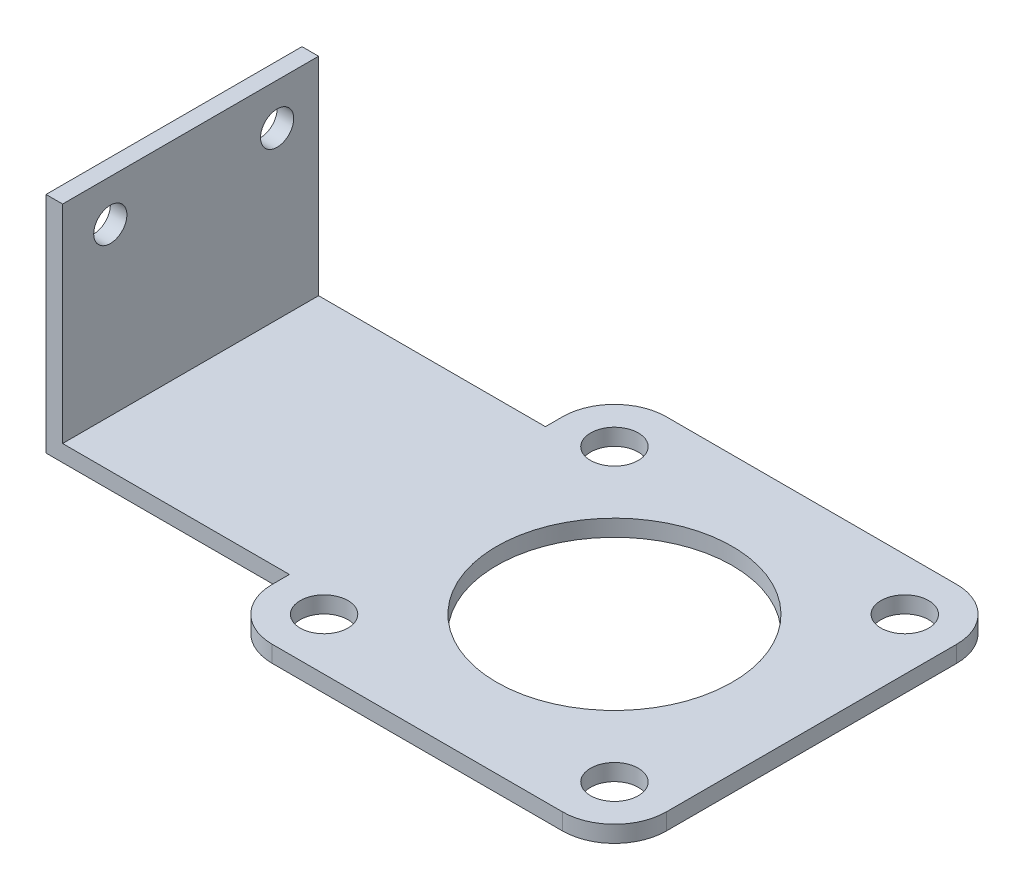
from build123d import *

# Parameters (mm, degrees)
BOSS_EXTRUDE1_DEPTH     = 4
CUT_EXTRUDE1_DEPTH      = 10
CUT_EXTRUDE1_DEPTH_BACK = 10
SKETCH2_R               = 5.75
BOSS_EXTRUDE5_DEPTH     = 58.68
SKETCH12_W              = 4
SKETCH12_H              = 61.717483032
BOSS_EXTRUDE8_DEPTH     = 50
SKETCH13_R              = 4
CUT_EXTRUDE5_DEPTH      = 20
SKETCH14_R              = 28.395
CUT_EXTRUDE6_DEPTH      = 10


with BuildPart() as part:
    # Sketch1 → Boss-Extrude1 (new body)
    with BuildSketch(Plane(origin=(0, 0, 0), x_dir=(1, 0, 0), z_dir=(0, 1, 0))):
        with BuildLine():
            Line((12.5, 0), (82.5, 0))
            ThreePointArc((82.5, 0), (91.338834765, 3.661165235), (95, 12.5))
            Line((95, 12.5), (95, 82.5))
            ThreePointArc((95, 82.5), (91.338834765, 91.338834765), (82.5, 95))
            Line((82.5, 95), (12.5, 95))
            ThreePointArc((12.5, 95), (3.661165235, 91.338834765), (0, 82.5))
            Line((0, 82.5), (0, 12.5))
            ThreePointArc((0, 12.5), (3.661165235, 3.661165235), (12.5, 0))
        make_face()
    extrude(amount=BOSS_EXTRUDE1_DEPTH)

    # Sketch2 → Cut-Extrude1 (cut, two sides: drawn at the far end of the back side and taken through both)
    with BuildSketch(Plane(origin=(0, 4, 0), x_dir=(1, 0, 0), z_dir=(0, 1, 0)).offset(-CUT_EXTRUDE1_DEPTH_BACK)):
        with Locations(Location((12.5, 82.5, 0), (0, 0, 90))):
            Circle(SKETCH2_R)
        with Locations(Location((82.5, 82.5, 0), (0, 0, 90))):
            Circle(SKETCH2_R)
        with Locations(Location((12.5, 12.5, 0), (0, 0, 90))):
            Circle(SKETCH2_R)
        with Locations(Location((82.5, 12.5, 0), (0, 0, 90))):
            Circle(SKETCH2_R)
    extrude(amount=CUT_EXTRUDE1_DEPTH + CUT_EXTRUDE1_DEPTH_BACK, mode=Mode.SUBTRACT)

    # Sketch8 → Boss-Extrude5 (add)
    with BuildSketch(Plane.ZY):
        Polygon((-17.641258484, 4), (-16.641258484, 4), (-16.641258484, 0), (-78.358741516, 0), (-78.358741516, 4), (-77.358741516, 4), align=None)
    extrude(amount=BOSS_EXTRUDE5_DEPTH)

    # Sketch12 → Boss-Extrude8 (add)
    with BuildSketch(Plane(origin=(0, 4, 0), x_dir=(1, 0, 0), z_dir=(0, 1, 0))):
        with Locations((-56.68, 47.5)):
            Rectangle(SKETCH12_W, SKETCH12_H)
    extrude(amount=BOSS_EXTRUDE8_DEPTH)

    # Sketch13 → Cut-Extrude5 (cut)
    with BuildSketch(Plane.ZY.offset(58.68)):
        with Locations((-68.358741516, 44)):
            Circle(SKETCH13_R)
        with Locations((-28.141258484, 44)):
            Circle(SKETCH13_R)
    extrude(amount=-CUT_EXTRUDE5_DEPTH, mode=Mode.SUBTRACT)

    # Sketch14 → Cut-Extrude6 (cut)
    with BuildSketch(Plane(origin=(0, 4, 0), x_dir=(1, 0, 0), z_dir=(0, 1, 0))):
        with Locations(Location((47.5, 47.5, 0), (0, 0, 270))):
            Circle(SKETCH14_R)
    extrude(amount=-CUT_EXTRUDE6_DEPTH, mode=Mode.SUBTRACT)


solid = part.part
